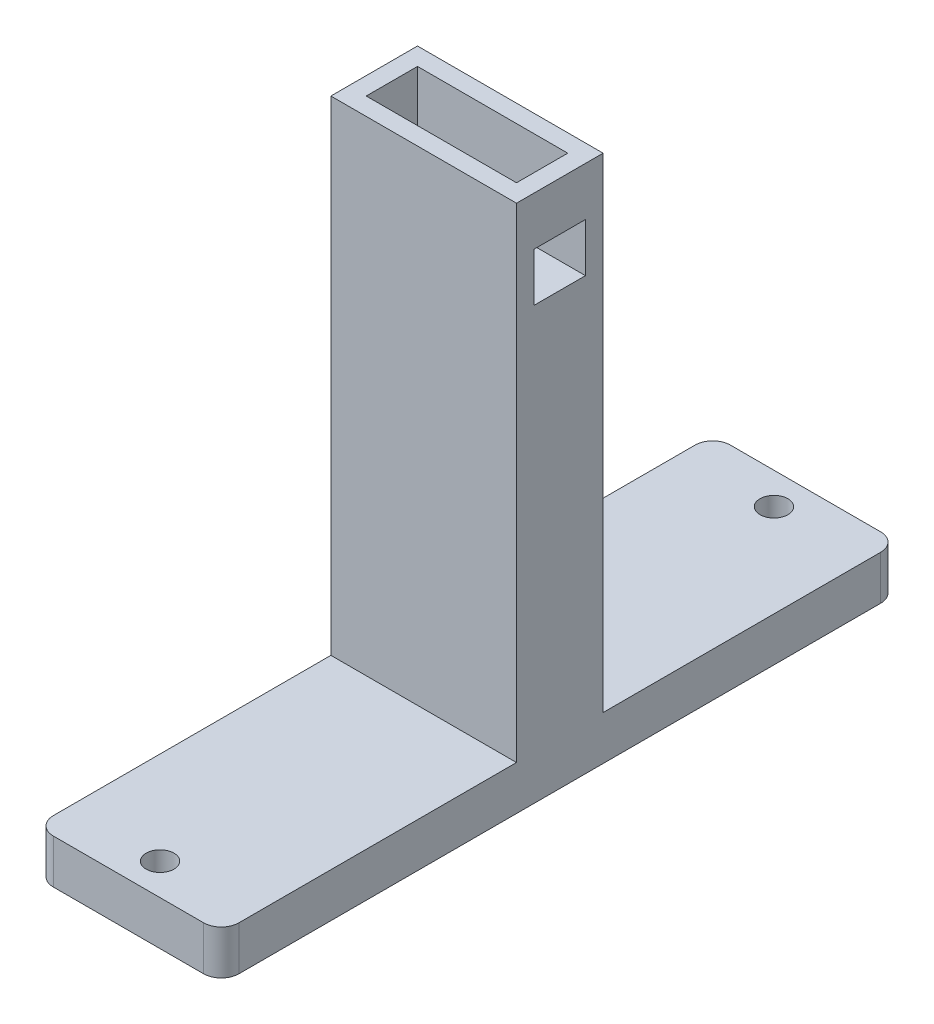
from build123d import *

# Parameters (mm, degrees)
SKETCH1_R             = 2
BOSS_EXTRUDE1_DEPTH   = 6.35
BOSS_EXTRUDE1_2_DEPTH = 6.35
SKETCH1_3_W           = 26.67
SKETCH1_3_H           = 12.446
BOSS_EXTRUDE2_DEPTH   = 61.976
SKETCH2_W             = 26.67
SKETCH2_H             = 12.446
SKETCH2_W_2           = 21.59
SKETCH2_H_2           = 7.366
BOSS_EXTRUDE3_DEPTH   = 13.97
SKETCH3_W             = 7.366
SKETCH3_H             = 6.985
CUT_EXTRUDE1_DEPTH    = 13.97


with BuildPart() as part:
    # Sketch1 → Boss-Extrude1 (new body)
    with BuildSketch(Plane(origin=(0, 0, 0), x_dir=(1, 0, 0), z_dir=(0, 1, 0))):
        with BuildLine():
            Line((-13.335, 6.223), (13.335, 6.223))
            Line((13.335, 6.223), (13.335, 46.101))
            ThreePointArc((13.335, 46.101), (12.591051224, 47.897051224), (10.795, 48.641))
            Line((10.795, 48.641), (-10.795, 48.641))
            ThreePointArc((-10.795, 48.641), (-12.591051224, 47.897051224), (-13.335, 46.101))
            Line((-13.335, 46.101), (-13.335, 6.223))
        make_face()
        with Locations((0, 44.101004)):
            Circle(SKETCH1_R, mode=Mode.SUBTRACT)
    extrude(amount=BOSS_EXTRUDE1_DEPTH)



with BuildPart() as body_2:
    # Sketch1 → Boss-Extrude1 2 (new body)
    with BuildSketch(Plane(origin=(0, 0, 0), x_dir=(1, 0, 0), z_dir=(0, 1, 0))):
        with BuildLine():
            Line((13.335, -46.101), (13.335, -6.223))
            Line((13.335, -6.223), (-13.335, -6.223))
            Line((-13.335, -6.223), (-13.335, -46.101))
            ThreePointArc((-13.335, -46.101), (-12.591051224, -47.897051224), (-10.795, -48.641))
            Line((-10.795, -48.641), (10.795, -48.641))
            ThreePointArc((10.795, -48.641), (12.591051224, -47.897051224), (13.335, -46.101))
        make_face()
        with Locations((0, -44.101004)):
            Circle(SKETCH1_R, mode=Mode.SUBTRACT)
    extrude(amount=BOSS_EXTRUDE1_2_DEPTH)


with BuildPart() as part_1:
    add(part.part)

    add(body_2.part)  # Boss-Extrude2 merges body 2
    # Sketch1<3> → Boss-Extrude2 (add)
    with BuildSketch(Plane(origin=(0, 0, 0), x_dir=(1, 0, 0), z_dir=(0, 1, 0))):
        Rectangle(SKETCH1_3_W, SKETCH1_3_H)
    extrude(amount=BOSS_EXTRUDE2_DEPTH)

    # Sketch2 → Boss-Extrude3 (add)
    with BuildSketch(Plane(origin=(0, 61.976, 0), x_dir=(1, 0, 0), z_dir=(0, 1, 0))):
        Rectangle(SKETCH2_W, SKETCH2_H)
        Rectangle(SKETCH2_W_2, SKETCH2_H_2, mode=Mode.SUBTRACT)
    extrude(amount=BOSS_EXTRUDE3_DEPTH)

    # Sketch3 → Cut-Extrude1 (cut)
    with BuildSketch(Plane(origin=(13.335, 0, 0), x_dir=(0, 0, -1), z_dir=(1, 0, 0))):
        with Locations((0, 65.4685)):
            Rectangle(SKETCH3_W, SKETCH3_H)
    extrude(amount=-CUT_EXTRUDE1_DEPTH, mode=Mode.SUBTRACT)


solid = part_1.part
